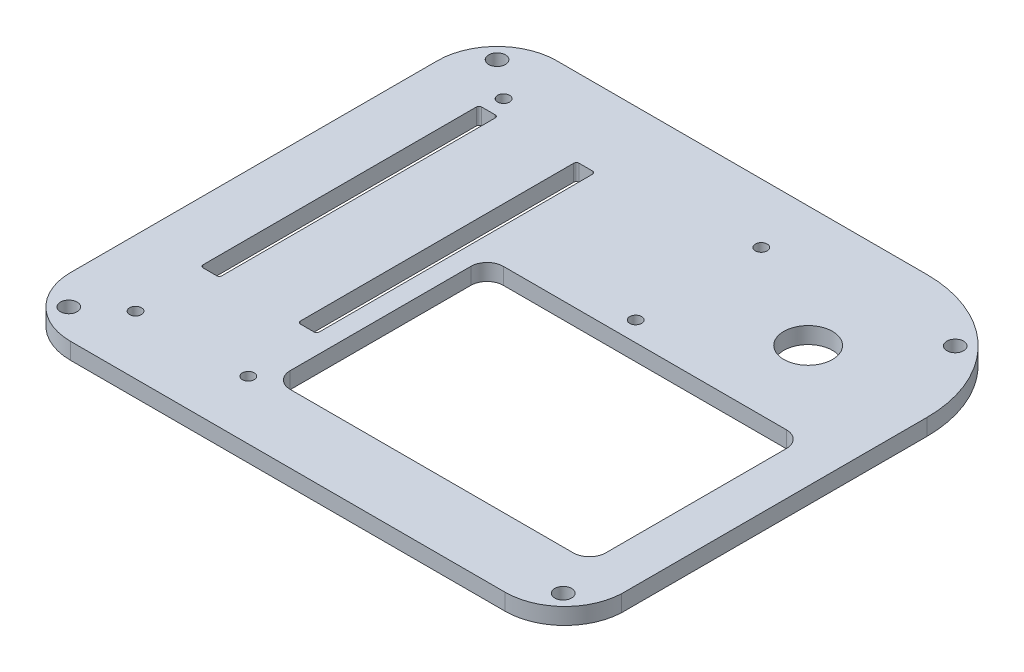
from build123d import *

# Parameters (mm, degrees)
SKETCH2_R           = 1.1
SKETCH2_R_2         = 4.5
SKETCH2_R_3         = 1.55
BOSS_EXTRUDE1_DEPTH = 3.048


with BuildPart() as part:
    # Sketch2 → Boss-Extrude1 (new body)
    with BuildSketch(Plane(origin=(0, 0, 0), x_dir=(1, 0, 0), z_dir=(0, 1, 0))):
        with BuildLine():
            Line((3, 8), (71.45, 8))
            ThreePointArc((71.45, 8), (87.628603154, 1.298603154), (94.33, -14.88))
            Line((94.33, -14.88), (94.33, -71.310147445))
            ThreePointArc((94.33, -71.310147445), (90.950189058, -78.782657675), (83.340051803, -81.84))
            Line((83.340051803, -81.84), (3, -81.84))
            ThreePointArc((3, -81.84), (-4.778174593, -78.618174593), (-8, -70.84))
            Line((-8, -70.84), (-8, -3))
            ThreePointArc((-8, -3), (-4.778174593, 4.778174593), (3, 8))
        make_face()
        with Locations(Location((4.19, -71.01, 0), (0, 0, 90))):
            Circle(SKETCH2_R, mode=Mode.SUBTRACT)
        with Locations(Location((25.03, -71.01, 0), (0, 0, 90))):
            Circle(SKETCH2_R, mode=Mode.SUBTRACT)
        with Locations(Location((4.19, -2.98, 0), (0, 0, 90))):
            Circle(SKETCH2_R, mode=Mode.SUBTRACT)
        with Locations(Location((51.82, -2.98, 0), (0, 0, 90))):
            Circle(SKETCH2_R, mode=Mode.SUBTRACT)
        with Locations(Location((51.82, -26.2, 0), (0, 0, 90))):
            Circle(SKETCH2_R, mode=Mode.SUBTRACT)
        with Locations(Location((71.83, -14.33, 0), (0, 0, 90))):
            Circle(SKETCH2_R_2, mode=Mode.SUBTRACT)
        with Locations(Location((-2.656854249, 2.656854249, 0), (0, 0, 90))):
            Circle(SKETCH2_R_3, mode=Mode.SUBTRACT)
        with Locations(Location((85.50728281, -0.82271719, 0), (0, 0, 90))):
            Circle(SKETCH2_R_3, mode=Mode.SUBTRACT)
        with Locations(Location((88.858862501, -76.631761762, 0), (0, 0, 90))):
            Circle(SKETCH2_R_3, mode=Mode.SUBTRACT)
        with Locations(Location((-2.656854249, -76.496854249, 0), (0, 0, 90))):
            Circle(SKETCH2_R_3, mode=Mode.SUBTRACT)
        with BuildLine():
            Line((28, -66.24), (28, -32.84))
            ThreePointArc((28, -32.84), (28.878679656, -30.718679656), (31, -29.84))
            Line((31, -29.84), (83.33, -29.84))
            ThreePointArc((83.33, -29.84), (85.451320344, -30.718679656), (86.33, -32.84))
            Line((86.33, -32.84), (86.33, -66.24))
            ThreePointArc((86.33, -66.24), (85.451320344, -68.361320344), (83.33, -69.24))
            Line((83.33, -69.24), (31, -69.24))
            ThreePointArc((31, -69.24), (28.878679656, -68.361320344), (28, -66.24))
        make_face(mode=Mode.SUBTRACT)
        with BuildLine():
            Line((6.5, -6.84), (6.5, -57.34))
            ThreePointArc((6.5, -57.34), (6.353553391, -57.693553391), (6, -57.84))
            Line((6, -57.84), (3.5, -57.84))
            ThreePointArc((3.5, -57.84), (3.146446609, -57.693553391), (3, -57.34))
            Line((3, -57.34), (3, -6.84))
            ThreePointArc((3, -6.84), (3.146446609, -6.486446609), (3.5, -6.34))
            Line((3.5, -6.34), (6, -6.34))
            ThreePointArc((6, -6.34), (6.353553391, -6.486446609), (6.5, -6.84))
        make_face(mode=Mode.SUBTRACT)
        with BuildLine():
            Line((24.5, -6.84), (24.5, -57.34))
            ThreePointArc((24.5, -57.34), (24.353553391, -57.693553391), (24, -57.84))
            Line((24, -57.84), (21.5, -57.84))
            ThreePointArc((21.5, -57.84), (21.146446609, -57.693553391), (21, -57.34))
            Line((21, -57.34), (21, -6.84))
            ThreePointArc((21, -6.84), (21.146446609, -6.486446609), (21.5, -6.34))
            Line((21.5, -6.34), (24, -6.34))
            ThreePointArc((24, -6.34), (24.353553391, -6.486446609), (24.5, -6.84))
        make_face(mode=Mode.SUBTRACT)
    extrude(amount=BOSS_EXTRUDE1_DEPTH)


solid = part.part
